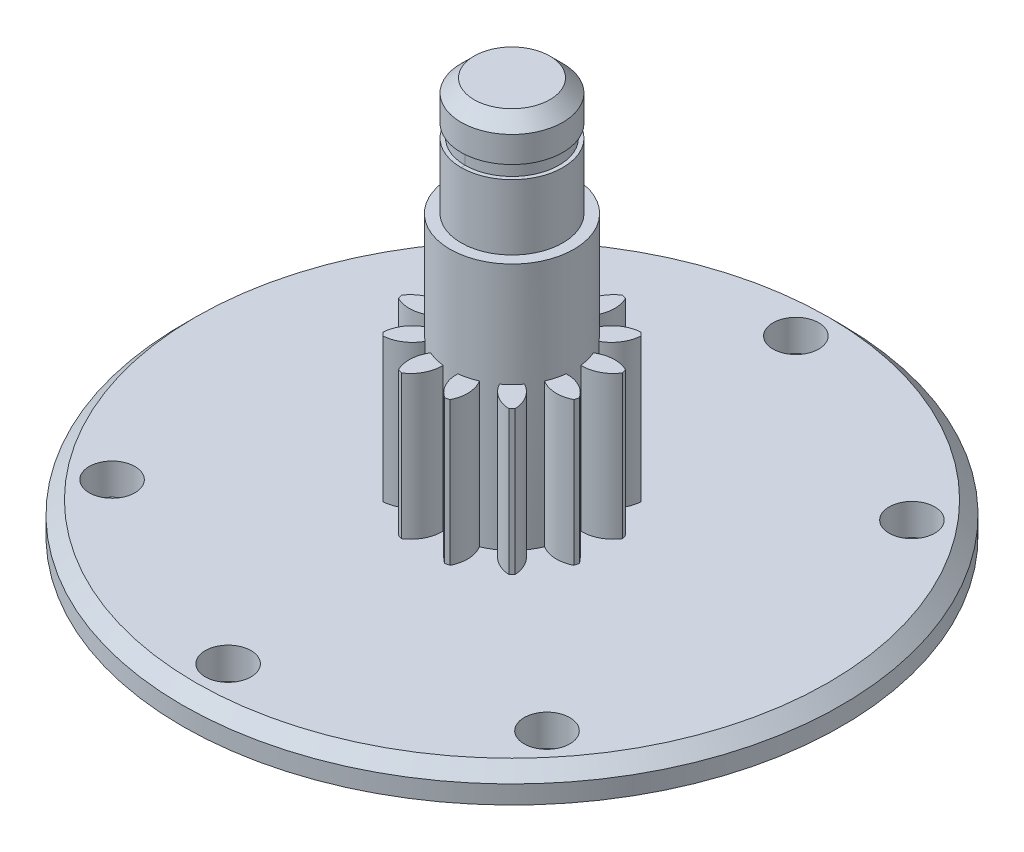
from build123d import *

# Parameters (mm, degrees)
SKETCH1_R           = 25.25
SKETCH1_R_2         = 1.75
BOSS_EXTRUDE1_DEPTH = 2.4
SKETCH3_R           = 7
BOSS_EXTRUDE3_DEPTH = 11
CUT_EXTRUDE1_DEPTH  = 11
CIRPATTERN1_COUNT   = 12
CHAMFER1_SIZE       = 1
BOSS_EXTRUDE4_START = 8
SKETCH6_R           = 4.749
BOSS_EXTRUDE4_DEPTH = 8
BOSS_EXTRUDE5_START = 8
SKETCH6_3_R         = 3.9
BOSS_EXTRUDE5_DEPTH = 9
CHAMFER2_SIZE       = 1
SKETCH7_W           = 0.3
SKETCH7_H           = 1


with BuildPart() as part:
    # Sketch1 → Boss-Extrude1 (new body)
    with BuildSketch(Plane(origin=(0, 0, 0), x_dir=(1, 0, 0), z_dir=(0, 1, 0))):
        with Locations(Location((0, 0, 0), (0, 0, 270))):
            Circle(SKETCH1_R)
        with Locations(Location((0, 21.75, 0), (0, 0, 270))):
            Circle(SKETCH1_R_2, mode=Mode.SUBTRACT)
        with Locations(Location((-16.661466638, 13.980630511, 0), (0, 0, 270))):
            Circle(SKETCH1_R_2, mode=Mode.SUBTRACT)
        with Locations(Location((16.661466638, 13.980630511, 0), (0, 0, 90))):
            Circle(SKETCH1_R_2, mode=Mode.SUBTRACT)
        with Locations(Location((16.661466638, -13.980630511, 0), (0, 0, 270))):
            Circle(SKETCH1_R_2, mode=Mode.SUBTRACT)
        with Locations(Location((0, -21.75, 0), (0, 0, 90))):
            Circle(SKETCH1_R_2, mode=Mode.SUBTRACT)
        with Locations(Location((-16.661466638, -13.980630511, 0), (0, 0, 90))):
            Circle(SKETCH1_R_2, mode=Mode.SUBTRACT)
    extrude(amount=BOSS_EXTRUDE1_DEPTH)

    # Sketch3 → Boss-Extrude3 (add)
    with BuildSketch(Plane(origin=(0, 2.4, 0), x_dir=(1, 0, 0), z_dir=(0, 1, 0))):
        with Locations(Location((0, 0, 0), (0, 0, 270))):
            Circle(SKETCH3_R)
    extrude(amount=BOSS_EXTRUDE3_DEPTH)

    # Sketch4 → Cut-Extrude1 (cut)
    with BuildSketch(Plane(origin=(0, 13.4, 0), x_dir=(1, 0, 0), z_dir=(0, 1, 0))):
        with BuildLine():
            ThreePointArc((0.562207301, 4.715604304), (0, 4.749), (-0.562207301, 4.715604304))
            ThreePointArc((-0.562207301, 4.715604304), (-0.837528627, 5.917009812), (-1.672850686, 6.823328788))
            ThreePointArc((-1.672850686, 6.823328788), (0, 7.0254), (1.672850686, 6.823328788))
            ThreePointArc((1.672850686, 6.823328788), (0.837528627, 5.917009812), (0.562207301, 4.715604304))
        make_face()
    cut_extrude1 = extrude(amount=-CUT_EXTRUDE1_DEPTH, mode=Mode.SUBTRACT)

    # CirPattern1: Cut-Extrude1 ×12 about axis
    cirpattern1_axis = Axis((0, 0, 0), (0, 1, 0))
    for i in range(1, CIRPATTERN1_COUNT):
        add(cut_extrude1.rotate(cirpattern1_axis, i * 360 / CIRPATTERN1_COUNT), mode=Mode.SUBTRACT)

    # Chamfer1
    chamfer1_edges = [part.edges().sort_by_distance(p)[0] for p in [
        (0, 2.4, -25.25),
    ]]
    chamfer(chamfer1_edges, length=CHAMFER1_SIZE)

    # Sketch6 → Boss-Extrude4 (add)
    with BuildSketch(Plane(origin=(0, 13.4, 0), x_dir=(1, 0, 0), z_dir=(0, 1, 0)).offset(BOSS_EXTRUDE4_START)):
        with Locations(Location((0, 0, 0), (0, 0, 270))):
            Circle(SKETCH6_R)
    extrude(amount=-BOSS_EXTRUDE4_DEPTH)

    # Sketch6<3> → Boss-Extrude5 (add)
    with BuildSketch(Plane(origin=(0, 13.4, 0), x_dir=(1, 0, 0), z_dir=(0, 1, 0)).offset(BOSS_EXTRUDE5_START)):
        with Locations(Location((0, 0, 0), (0, 0, 270))):
            Circle(SKETCH6_3_R)
    extrude(amount=BOSS_EXTRUDE5_DEPTH)

    # Chamfer2
    chamfer2_edges = [part.edges().sort_by_distance(p)[0] for p in [
        (0, 30.4, -3.9),
    ]]
    chamfer(chamfer2_edges, length=CHAMFER2_SIZE)

    # Cut-Sweep1: sweep along a curve in space
    with BuildLine() as cut_sweep1_path:
        ThreePointArc((0, 29.4, 3.9), (2.757716447, 29.4, 2.757716447), (3.9, 29.4, 0))
        ThreePointArc((3.9, 29.4, 0), (2.757716447, 29.4, -2.757716447), (0, 29.4, -3.9))
        ThreePointArc((0, 29.4, -3.9), (-2.757716447, 29.4, -2.757716447), (-3.9, 29.4, 0))
        ThreePointArc((-3.9, 29.4, 0), (-2.757716447, 29.4, 2.757716447), (0, 29.4, 3.9))
    # Sketch7 → Cut-Sweep1 (sweep, cut)
    with BuildSketch(Plane.XY):
        with Locations((-3.75, 26.9)):
            Rectangle(SKETCH7_W, SKETCH7_H)
    sweep(path=cut_sweep1_path.line, mode=Mode.SUBTRACT)


solid = part.part
